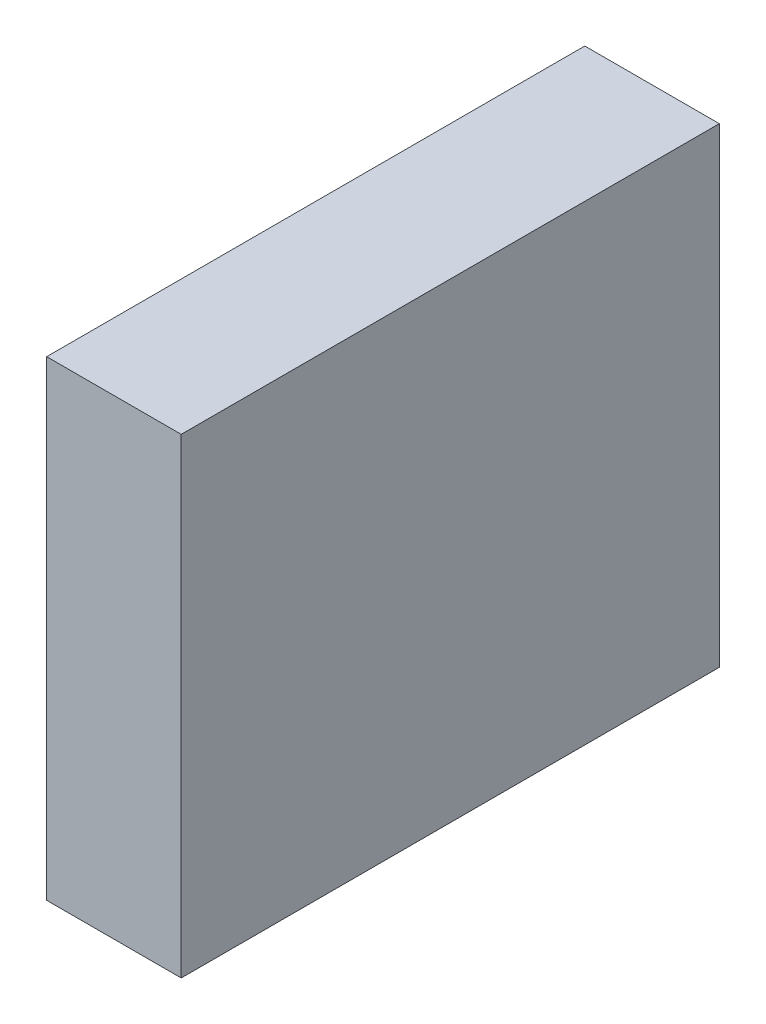
from build123d import *

# Parameters (mm, degrees)
SKETCH1_W                       = 10
SKETCH1_H                       = 35
BOSS_EXTRUDE1_DEPTH             = 40
M3X0_5_TAPPED_HOLE1_D           = 2.5
M3X0_5_TAPPED_HOLE1_DEPTH       = 11
M3X0_5_TAPPED_HOLE1_CSINK_D     = 3.05
M3X0_5_TAPPED_HOLE1_CSINK_ANGLE = 90
M3X0_5_TAPPED_HOLE1_TIP         = 0.751075774


with BuildPart() as part:
    # Sketch1 → Boss-Extrude1 (new body)
    with BuildSketch(Plane.XY):
        Rectangle(SKETCH1_W, SKETCH1_H)
    extrude(amount=BOSS_EXTRUDE1_DEPTH)

    # M3x0.5 Tapped Hole1
    with Locations(Plane(origin=(0, 0, 0), x_dir=(-1, 0, 0), z_dir=(0, 0, -1))):
        with Locations((0, 11.354900128), (0, -11.398741441)):
            CounterSinkHole(M3X0_5_TAPPED_HOLE1_D / 2, M3X0_5_TAPPED_HOLE1_CSINK_D / 2, depth=M3X0_5_TAPPED_HOLE1_DEPTH, counter_sink_angle=M3X0_5_TAPPED_HOLE1_CSINK_ANGLE)
            with Locations((0, 0, -(M3X0_5_TAPPED_HOLE1_DEPTH + M3X0_5_TAPPED_HOLE1_TIP / 2))):  # 118° drill point
                Cone(0, M3X0_5_TAPPED_HOLE1_D / 2, M3X0_5_TAPPED_HOLE1_TIP, mode=Mode.SUBTRACT)


solid = part.part
